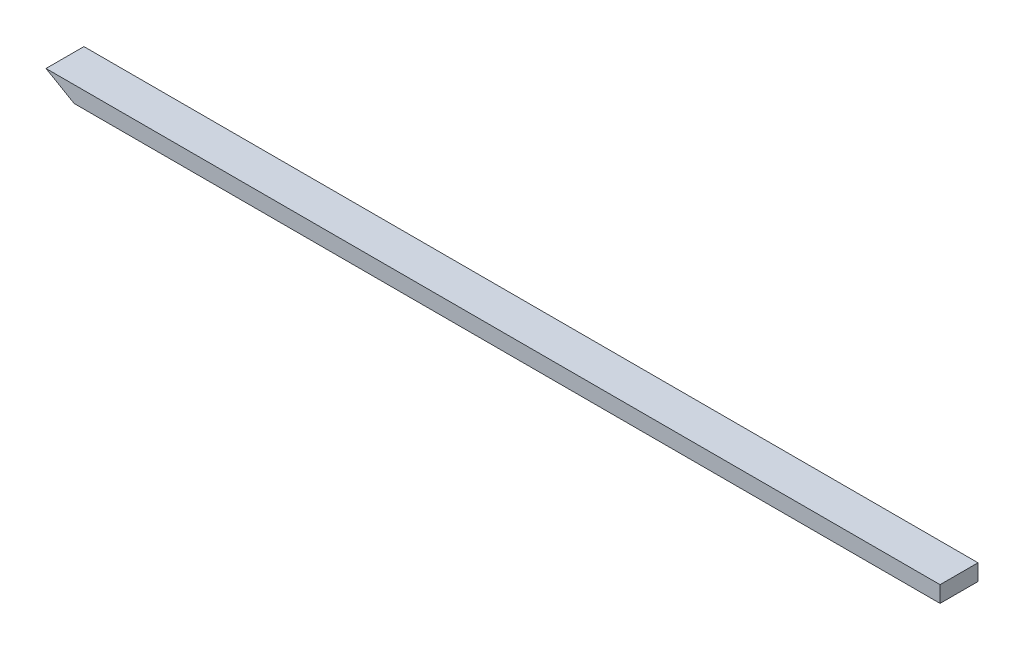
from build123d import *

# Parameters (mm, degrees)
SKETCH1_W               = 88.9
SKETCH1_H               = 38.1
BOSS_EXTRUDE1_DEPTH     = 1047.75
CUT_EXTRUDE1_DEPTH      = 1049.865466826
CUT_EXTRUDE1_DEPTH_BACK = 1049.865466826


with BuildPart() as part:
    # Sketch1 → Boss-Extrude1 (new, symmetric)
    with BuildSketch(Plane(origin=(0, 0, 0), x_dir=(0, 0, -1), z_dir=(1, 0, 0))):
        Rectangle(SKETCH1_W, SKETCH1_H)
    extrude(amount=BOSS_EXTRUDE1_DEPTH, both=True)

    # Sketch3 → Cut-Extrude1 (cut, two sides: drawn at the far end of the back side and taken through both)
    with BuildSketch(Plane.XY.offset(-CUT_EXTRUDE1_DEPTH_BACK)):
        Polygon((-1047.75, 19.05), (-981.758864232, -19.05), (-1047.75, -19.05), align=None)
    extrude(amount=CUT_EXTRUDE1_DEPTH + CUT_EXTRUDE1_DEPTH_BACK, mode=Mode.SUBTRACT)


solid = part.part
